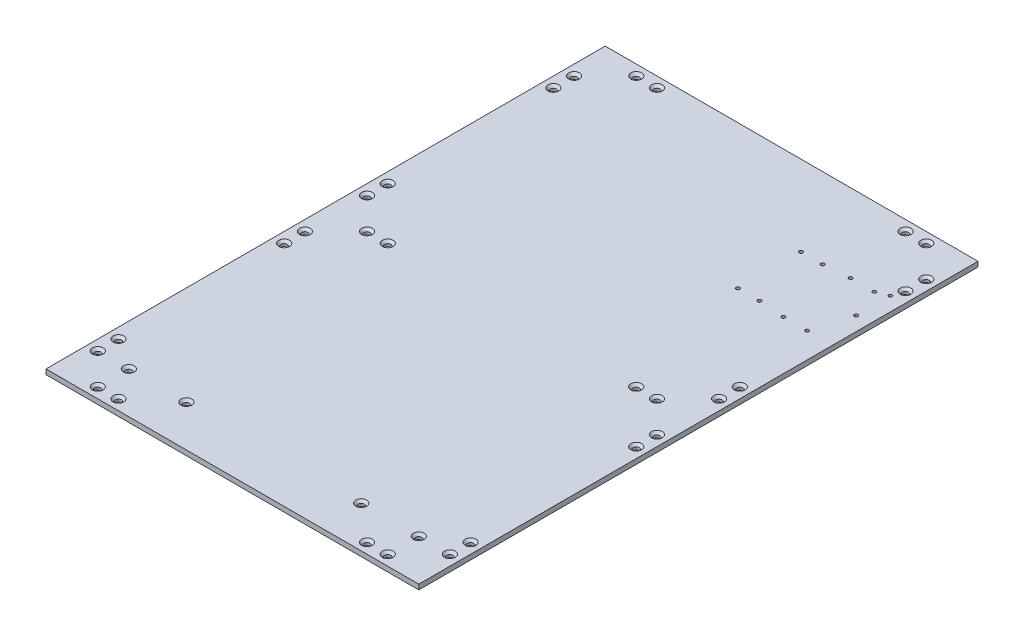
from build123d import *

# Parameters (mm, degrees)
SKETCH1_W                                      = 360
SKETCH1_H                                      = 540
BOSS_EXTRUDE1_DEPTH                            = 4.826
CSK_FOR_M5_FLAT_HEAD_MACHINE_SCREW1_AT_2_COUNT = 2
CSK_FOR_M5_FLAT_HEAD_MACHINE_SCREW1_AT_2_PITCH = 55.5625
CSK_FOR_M5_FLAT_HEAD_MACHINE_SCREW1_AT_3_COUNT = 2
CSK_FOR_M5_FLAT_HEAD_MACHINE_SCREW1_AT_3_PITCH = 224.4375
CSK_FOR_M5_FLAT_HEAD_MACHINE_SCREW1_AT_4_COUNT = 2
CSK_FOR_M5_FLAT_HEAD_MACHINE_SCREW1_AT_4_PITCH = 280
CSK_FOR_M5_FLAT_HEAD_MACHINE_SCREW2_AT_2_COUNT = 2
CSK_FOR_M5_FLAT_HEAD_MACHINE_SCREW2_AT_2_PITCH = 42.426406871
CSK_FOR_M5_FLAT_HEAD_MACHINE_SCREW2_AT_3_COUNT = 2
CSK_FOR_M5_FLAT_HEAD_MACHINE_SCREW2_AT_3_PITCH = 280
CSK_FOR_M5_FLAT_HEAD_MACHINE_SCREW2_AT_4_COUNT = 2
CSK_FOR_M5_FLAT_HEAD_MACHINE_SCREW2_AT_4_PITCH = 311.448230048
CSK_FOR_M5_FLAT_HEAD_MACHINE_SCREW2_AT_5_COUNT = 2
CSK_FOR_M5_FLAT_HEAD_MACHINE_SCREW2_AT_5_PITCH = 231.948270095
CSK_FOR_M5_FLAT_HEAD_MACHINE_SCREW2_AT_6_COUNT = 2
CSK_FOR_M5_FLAT_HEAD_MACHINE_SCREW2_AT_6_PITCH = 260
CSK_FOR_M5_FLAT_HEAD_MACHINE_SCREW2_AT_7_COUNT = 2
CSK_FOR_M5_FLAT_HEAD_MACHINE_SCREW2_AT_7_PITCH = 291.547594742
CSK_FOR_M5_FLAT_HEAD_MACHINE_SCREW2_AT_8_COUNT = 2
CSK_FOR_M5_FLAT_HEAD_MACHINE_SCREW2_AT_8_PITCH = 386.005181312
CSK_FOR_M5_FLAT_HEAD_MACHINE_SCREW2_AT_9_COUNT = 2
CSK_FOR_M5_FLAT_HEAD_MACHINE_SCREW2_AT_9_PITCH = 382.099463491
CSK_FOR_M5_FLAT_HEAD_MACHINE_SCREW2_AT_1_COUNT = 2
CSK_FOR_M5_FLAT_HEAD_MACHINE_SCREW2_AT_1_PITCH = 424.499705536
CSK_FOR_M5_FLAT_HEAD_MACHINE_SCREW2_2_COUNT    = 2
CSK_FOR_M5_FLAT_HEAD_MACHINE_SCREW2_2_PITCH    = 490.917508345
CSK_FOR_M5_FLAT_HEAD_MACHINE_SCREW2_3_COUNT    = 2
CSK_FOR_M5_FLAT_HEAD_MACHINE_SCREW2_3_PITCH    = 520
CSK_FOR_M5_FLAT_HEAD_MACHINE_SCREW2_4_COUNT    = 2
CSK_FOR_M5_FLAT_HEAD_MACHINE_SCREW2_4_PITCH    = 590.592922409
CSK_FOR_M5_FLAT_HEAD_MACHINE_SCREW2_5_COUNT    = 2
CSK_FOR_M5_FLAT_HEAD_MACHINE_SCREW2_5_PITCH    = 579.827560573
CSK_FOR_M5_FLAT_HEAD_MACHINE_SCREW2_6_COUNT    = 2
CSK_FOR_M5_FLAT_HEAD_MACHINE_SCREW2_6_PITCH    = 470.956473573
CSK_FOR_M5_FLAT_HEAD_MACHINE_SCREW2_7_COUNT    = 2
CSK_FOR_M5_FLAT_HEAD_MACHINE_SCREW2_7_PITCH    = 520.38447325
CSK_FOR_M5_FLAT_HEAD_MACHINE_SCREW2_8_COUNT    = 2
CSK_FOR_M5_FLAT_HEAD_MACHINE_SCREW2_8_PITCH    = 581.37767415
CSK_FOR_M5_FLAT_HEAD_MACHINE_SCREW2_9_COUNT    = 2
CSK_FOR_M5_FLAT_HEAD_MACHINE_SCREW2_9_PITCH    = 563.02753041
CSK_FOR_M5_FLAT_HEAD_MACHINE_SCREW2_10_COUNT   = 2
CSK_FOR_M5_FLAT_HEAD_MACHINE_SCREW2_10_PITCH   = 438.406204336
CSK_FOR_M5_FLAT_HEAD_MACHINE_SCREW2_11_COUNT   = 2
CSK_FOR_M5_FLAT_HEAD_MACHINE_SCREW2_11_PITCH   = 367.695526217
CSK_FOR_M5_FLAT_HEAD_MACHINE_SCREW2_12_COUNT   = 2
CSK_FOR_M5_FLAT_HEAD_MACHINE_SCREW2_12_PITCH   = 374.432904537
CSK_FOR_M5_FLAT_HEAD_MACHINE_SCREW2_13_COUNT   = 2
CSK_FOR_M5_FLAT_HEAD_MACHINE_SCREW2_13_PITCH   = 212.132034356
CSK_FOR_M5_FLAT_HEAD_MACHINE_SCREW2_14_COUNT   = 2
CSK_FOR_M5_FLAT_HEAD_MACHINE_SCREW2_14_PITCH   = 260.768096208
CSK_FOR_M5_FLAT_HEAD_MACHINE_SCREW2_15_COUNT   = 2
CSK_FOR_M5_FLAT_HEAD_MACHINE_SCREW2_15_PITCH   = 311.448230048
CSK_FOR_M5_FLAT_HEAD_MACHINE_SCREW2_16_COUNT   = 2
CSK_FOR_M5_FLAT_HEAD_MACHINE_SCREW2_16_PITCH   = 58.309518948
CSK_FOR_M5_FLAT_HEAD_MACHINE_SCREW2_17_COUNT   = 2
CSK_FOR_M5_FLAT_HEAD_MACHINE_SCREW2_17_PITCH   = 20
CSK_FOR_M5_FLAT_HEAD_MACHINE_SCREW2_18_COUNT   = 2
CSK_FOR_M5_FLAT_HEAD_MACHINE_SCREW2_18_PITCH   = 260
CSK_FOR_M5_FLAT_HEAD_MACHINE_SCREW2_19_COUNT   = 2
CSK_FOR_M5_FLAT_HEAD_MACHINE_SCREW2_19_PITCH   = 314.006369362
SKETCH22_R                                     = 1.8
SKETCH22_R_2                                   = 1.7
CUT_EXTRUDE2_DEPTH                             = 9.826000001


with BuildPart() as part:
    # Sketch1 → Boss-Extrude1 (new body)
    with BuildSketch(Plane(origin=(0, 0, 0), x_dir=(1, 0, 0), z_dir=(0, 1, 0))):
        with Locations((180, 270)):
            Rectangle(SKETCH1_W, SKETCH1_H)
    extrude(amount=BOSS_EXTRUDE1_DEPTH)

    # Sketch16 → CSK for M5 Flat Head Machine Screw1 (revolve, cut)
    with BuildSketch(Plane(origin=(40, 4.826, -40), x_dir=(0, 0, 1), z_dir=(1, 0, 0))):
        Polygon((0, 0), (0, 4.826), (2.9, 4.826), (2.9, 2.3), (5.2, 0), align=None)
    csk_for_m5_flat_head_machine_screw1 = revolve(axis=Axis((40, 11.176, -40), (0, -1, 0)), mode=Mode.SUBTRACT)

    # CSK for M5 Flat Head Machine Screw1 at 2: CSK for M5 Flat Head Machine Screw1 ×2
    with Locations(*[(i * CSK_FOR_M5_FLAT_HEAD_MACHINE_SCREW1_AT_2_PITCH, 0, 0) for i in range(1, CSK_FOR_M5_FLAT_HEAD_MACHINE_SCREW1_AT_2_COUNT)]):
        add(csk_for_m5_flat_head_machine_screw1, mode=Mode.SUBTRACT)

    # CSK for M5 Flat Head Machine Screw1 at 3: CSK for M5 Flat Head Machine Screw1 ×2
    with Locations(*[(i * CSK_FOR_M5_FLAT_HEAD_MACHINE_SCREW1_AT_3_PITCH, 0, 0) for i in range(1, CSK_FOR_M5_FLAT_HEAD_MACHINE_SCREW1_AT_3_COUNT)]):
        add(csk_for_m5_flat_head_machine_screw1, mode=Mode.SUBTRACT)

    # CSK for M5 Flat Head Machine Screw1 at 4: CSK for M5 Flat Head Machine Screw1 ×2
    with Locations(*[(i * CSK_FOR_M5_FLAT_HEAD_MACHINE_SCREW1_AT_4_PITCH, 0, 0) for i in range(1, CSK_FOR_M5_FLAT_HEAD_MACHINE_SCREW1_AT_4_COUNT)]):
        add(csk_for_m5_flat_head_machine_screw1, mode=Mode.SUBTRACT)

    # Sketch20 → CSK for M5 Flat Head Machine Screw2 (revolve, cut)
    with BuildSketch(Plane(origin=(40, 4.826, -10), x_dir=(0, 0, 1), z_dir=(1, 0, 0))):
        Polygon((0, 0), (0, 4.826), (2.9, 4.826), (2.9, 2.3), (5.2, 0), align=None)
    csk_for_m5_flat_head_machine_screw2 = revolve(axis=Axis((40, 11.176, -10), (0, -1, 0)), mode=Mode.SUBTRACT)

    # CSK for M5 Flat Head Machine Screw2 at 2: CSK for M5 Flat Head Machine Screw2 ×2
    with Locations(*[Vector(-0.7071067811865477, 0, -0.7071067811865475) * (i * CSK_FOR_M5_FLAT_HEAD_MACHINE_SCREW2_AT_2_PITCH) for i in range(1, CSK_FOR_M5_FLAT_HEAD_MACHINE_SCREW2_AT_2_COUNT)]):
        add(csk_for_m5_flat_head_machine_screw2, mode=Mode.SUBTRACT)

    # CSK for M5 Flat Head Machine Screw2 at 3: CSK for M5 Flat Head Machine Screw2 ×2
    with Locations(*[(i * CSK_FOR_M5_FLAT_HEAD_MACHINE_SCREW2_AT_3_PITCH, 0, 0) for i in range(1, CSK_FOR_M5_FLAT_HEAD_MACHINE_SCREW2_AT_3_COUNT)]):
        add(csk_for_m5_flat_head_machine_screw2, mode=Mode.SUBTRACT)

    # CSK for M5 Flat Head Machine Screw2 at 4: CSK for M5 Flat Head Machine Screw2 ×2
    with Locations(*[Vector(0.9953500135553002, 0, -0.09632419486019045) * (i * CSK_FOR_M5_FLAT_HEAD_MACHINE_SCREW2_AT_4_PITCH) for i in range(1, CSK_FOR_M5_FLAT_HEAD_MACHINE_SCREW2_AT_4_COUNT)]):
        add(csk_for_m5_flat_head_machine_screw2, mode=Mode.SUBTRACT)

    # CSK for M5 Flat Head Machine Screw2 at 5: CSK for M5 Flat Head Machine Screw2 ×2
    with Locations(*[Vector(-0.12933918406776806, 0, -0.9916004111862218) * (i * CSK_FOR_M5_FLAT_HEAD_MACHINE_SCREW2_AT_5_PITCH) for i in range(1, CSK_FOR_M5_FLAT_HEAD_MACHINE_SCREW2_AT_5_COUNT)]):
        add(csk_for_m5_flat_head_machine_screw2, mode=Mode.SUBTRACT)

    # CSK for M5 Flat Head Machine Screw2 at 6: CSK for M5 Flat Head Machine Screw2 ×2
    with Locations(*[(0, 0, -i * CSK_FOR_M5_FLAT_HEAD_MACHINE_SCREW2_AT_6_PITCH) for i in range(1, CSK_FOR_M5_FLAT_HEAD_MACHINE_SCREW2_AT_6_COUNT)]):
        add(csk_for_m5_flat_head_machine_screw2, mode=Mode.SUBTRACT)

    # CSK for M5 Flat Head Machine Screw2 at 7: CSK for M5 Flat Head Machine Screw2 ×2
    with Locations(*[Vector(-0.10289915108550529, 0, -0.9946917938265514) * (i * CSK_FOR_M5_FLAT_HEAD_MACHINE_SCREW2_AT_7_PITCH) for i in range(1, CSK_FOR_M5_FLAT_HEAD_MACHINE_SCREW2_AT_7_COUNT)]):
        add(csk_for_m5_flat_head_machine_screw2, mode=Mode.SUBTRACT)

    # CSK for M5 Flat Head Machine Screw2 at 8: CSK for M5 Flat Head Machine Screw2 ×2
    with Locations(*[Vector(0.8030980282338017, 0, -0.5958469241734659) * (i * CSK_FOR_M5_FLAT_HEAD_MACHINE_SCREW2_AT_8_PITCH) for i in range(1, CSK_FOR_M5_FLAT_HEAD_MACHINE_SCREW2_AT_8_COUNT)]):
        add(csk_for_m5_flat_head_machine_screw2, mode=Mode.SUBTRACT)

    # CSK for M5 Flat Head Machine Screw2 at 9: CSK for M5 Flat Head Machine Screw2 ×2
    with Locations(*[Vector(0.7327934916262991, 0, -0.680451099367278) * (i * CSK_FOR_M5_FLAT_HEAD_MACHINE_SCREW2_AT_9_PITCH) for i in range(1, CSK_FOR_M5_FLAT_HEAD_MACHINE_SCREW2_AT_9_COUNT)]):
        add(csk_for_m5_flat_head_machine_screw2, mode=Mode.SUBTRACT)

    # CSK for M5 Flat Head Machine Screw2 at 1: CSK for M5 Flat Head Machine Screw2 ×2
    with Locations(*[Vector(0.7302714135188955, 0, -0.683157128775741) * (i * CSK_FOR_M5_FLAT_HEAD_MACHINE_SCREW2_AT_1_PITCH) for i in range(1, CSK_FOR_M5_FLAT_HEAD_MACHINE_SCREW2_AT_1_COUNT)]):
        add(csk_for_m5_flat_head_machine_screw2, mode=Mode.SUBTRACT)

    # CSK for M5 Flat Head Machine Screw2  2: CSK for M5 Flat Head Machine Screw2 ×2
    with Locations(*[Vector(-0.0611100632795033, 0, -0.9981310335652204) * (i * CSK_FOR_M5_FLAT_HEAD_MACHINE_SCREW2_2_PITCH) for i in range(1, CSK_FOR_M5_FLAT_HEAD_MACHINE_SCREW2_2_COUNT)]):
        add(csk_for_m5_flat_head_machine_screw2, mode=Mode.SUBTRACT)

    # CSK for M5 Flat Head Machine Screw2  3: CSK for M5 Flat Head Machine Screw2 ×2
    with Locations(*[(0, 0, -i * CSK_FOR_M5_FLAT_HEAD_MACHINE_SCREW2_3_PITCH) for i in range(1, CSK_FOR_M5_FLAT_HEAD_MACHINE_SCREW2_3_COUNT)]):
        add(csk_for_m5_flat_head_machine_screw2, mode=Mode.SUBTRACT)

    # CSK for M5 Flat Head Machine Screw2  4: CSK for M5 Flat Head Machine Screw2 ×2
    with Locations(*[Vector(0.4740998230350174, 0, -0.8804710999221753) * (i * CSK_FOR_M5_FLAT_HEAD_MACHINE_SCREW2_4_PITCH) for i in range(1, CSK_FOR_M5_FLAT_HEAD_MACHINE_SCREW2_4_COUNT)]):
        add(csk_for_m5_flat_head_machine_screw2, mode=Mode.SUBTRACT)

    # CSK for M5 Flat Head Machine Screw2  5: CSK for M5 Flat Head Machine Screw2 ×2
    with Locations(*[Vector(0.5346417126044627, 0, -0.8450788360522153) * (i * CSK_FOR_M5_FLAT_HEAD_MACHINE_SCREW2_5_PITCH) for i in range(1, CSK_FOR_M5_FLAT_HEAD_MACHINE_SCREW2_5_COUNT)]):
        add(csk_for_m5_flat_head_machine_screw2, mode=Mode.SUBTRACT)

    # CSK for M5 Flat Head Machine Screw2  6: CSK for M5 Flat Head Machine Screw2 ×2
    with Locations(*[Vector(-0.06370015422533803, 0, -0.9979690828636267) * (i * CSK_FOR_M5_FLAT_HEAD_MACHINE_SCREW2_6_PITCH) for i in range(1, CSK_FOR_M5_FLAT_HEAD_MACHINE_SCREW2_6_COUNT)]):
        add(csk_for_m5_flat_head_machine_screw2, mode=Mode.SUBTRACT)

    # CSK for M5 Flat Head Machine Screw2  7: CSK for M5 Flat Head Machine Screw2 ×2
    with Locations(*[Vector(0.03843312210120418, 0, -0.9992611746313144) * (i * CSK_FOR_M5_FLAT_HEAD_MACHINE_SCREW2_7_PITCH) for i in range(1, CSK_FOR_M5_FLAT_HEAD_MACHINE_SCREW2_7_COUNT)]):
        add(csk_for_m5_flat_head_machine_screw2, mode=Mode.SUBTRACT)

    # CSK for M5 Flat Head Machine Screw2  8: CSK for M5 Flat Head Machine Screw2 ×2
    with Locations(*[Vector(0.4472135954999574, 0, -0.8944271909999162) * (i * CSK_FOR_M5_FLAT_HEAD_MACHINE_SCREW2_8_PITCH) for i in range(1, CSK_FOR_M5_FLAT_HEAD_MACHINE_SCREW2_8_COUNT)]):
        add(csk_for_m5_flat_head_machine_screw2, mode=Mode.SUBTRACT)

    # CSK for M5 Flat Head Machine Screw2  9: CSK for M5 Flat Head Machine Screw2 ×2
    with Locations(*[Vector(0.5505947458271752, 0, -0.8347726791573312) * (i * CSK_FOR_M5_FLAT_HEAD_MACHINE_SCREW2_9_PITCH) for i in range(1, CSK_FOR_M5_FLAT_HEAD_MACHINE_SCREW2_9_COUNT)]):
        add(csk_for_m5_flat_head_machine_screw2, mode=Mode.SUBTRACT)

    # CSK for M5 Flat Head Machine Screw2  10: CSK for M5 Flat Head Machine Screw2 ×2
    with Locations(*[Vector(0.7071067811865475, 0, -0.7071067811865476) * (i * CSK_FOR_M5_FLAT_HEAD_MACHINE_SCREW2_10_PITCH) for i in range(1, CSK_FOR_M5_FLAT_HEAD_MACHINE_SCREW2_10_COUNT)]):
        add(csk_for_m5_flat_head_machine_screw2, mode=Mode.SUBTRACT)

    # CSK for M5 Flat Head Machine Screw2  11: CSK for M5 Flat Head Machine Screw2 ×2
    with Locations(*[Vector(0.7071067811865476, 0, -0.7071067811865476) * (i * CSK_FOR_M5_FLAT_HEAD_MACHINE_SCREW2_11_PITCH) for i in range(1, CSK_FOR_M5_FLAT_HEAD_MACHINE_SCREW2_11_COUNT)]):
        add(csk_for_m5_flat_head_machine_screw2, mode=Mode.SUBTRACT)

    # CSK for M5 Flat Head Machine Screw2  12: CSK for M5 Flat Head Machine Screw2 ×2
    with Locations(*[Vector(0.827918690488332, 0, -0.5608481451695152) * (i * CSK_FOR_M5_FLAT_HEAD_MACHINE_SCREW2_12_PITCH) for i in range(1, CSK_FOR_M5_FLAT_HEAD_MACHINE_SCREW2_12_COUNT)]):
        add(csk_for_m5_flat_head_machine_screw2, mode=Mode.SUBTRACT)

    # CSK for M5 Flat Head Machine Screw2  13: CSK for M5 Flat Head Machine Screw2 ×2
    with Locations(*[Vector(-0.14142135623730953, 0, -0.9899494936611666) * (i * CSK_FOR_M5_FLAT_HEAD_MACHINE_SCREW2_13_PITCH) for i in range(1, CSK_FOR_M5_FLAT_HEAD_MACHINE_SCREW2_13_COUNT)]):
        add(csk_for_m5_flat_head_machine_screw2, mode=Mode.SUBTRACT)

    # CSK for M5 Flat Head Machine Screw2  14: CSK for M5 Flat Head Machine Screw2 ×2
    with Locations(*[Vector(0.07669649888473705, 0, -0.9970544855015816) * (i * CSK_FOR_M5_FLAT_HEAD_MACHINE_SCREW2_14_PITCH) for i in range(1, CSK_FOR_M5_FLAT_HEAD_MACHINE_SCREW2_14_COUNT)]):
        add(csk_for_m5_flat_head_machine_screw2, mode=Mode.SUBTRACT)

    # CSK for M5 Flat Head Machine Screw2  15: CSK for M5 Flat Head Machine Screw2 ×2
    with Locations(*[Vector(-0.09632419486019039, 0, -0.9953500135553002) * (i * CSK_FOR_M5_FLAT_HEAD_MACHINE_SCREW2_15_PITCH) for i in range(1, CSK_FOR_M5_FLAT_HEAD_MACHINE_SCREW2_15_COUNT)]):
        add(csk_for_m5_flat_head_machine_screw2, mode=Mode.SUBTRACT)

    # CSK for M5 Flat Head Machine Screw2  16: CSK for M5 Flat Head Machine Screw2 ×2
    with Locations(*[Vector(-0.5144957554275267, 0, -0.8574929257125442) * (i * CSK_FOR_M5_FLAT_HEAD_MACHINE_SCREW2_16_PITCH) for i in range(1, CSK_FOR_M5_FLAT_HEAD_MACHINE_SCREW2_16_COUNT)]):
        add(csk_for_m5_flat_head_machine_screw2, mode=Mode.SUBTRACT)

    # CSK for M5 Flat Head Machine Screw2  17: CSK for M5 Flat Head Machine Screw2 ×2
    with Locations(*[(i * CSK_FOR_M5_FLAT_HEAD_MACHINE_SCREW2_17_PITCH, 0, 0) for i in range(1, CSK_FOR_M5_FLAT_HEAD_MACHINE_SCREW2_17_COUNT)]):
        add(csk_for_m5_flat_head_machine_screw2, mode=Mode.SUBTRACT)

    # CSK for M5 Flat Head Machine Screw2  18: CSK for M5 Flat Head Machine Screw2 ×2
    with Locations(*[(i * CSK_FOR_M5_FLAT_HEAD_MACHINE_SCREW2_18_PITCH, 0, 0) for i in range(1, CSK_FOR_M5_FLAT_HEAD_MACHINE_SCREW2_18_COUNT)]):
        add(csk_for_m5_flat_head_machine_screw2, mode=Mode.SUBTRACT)

    # CSK for M5 Flat Head Machine Screw2  19: CSK for M5 Flat Head Machine Screw2 ×2
    with Locations(*[Vector(0.9872411207126471, 0, -0.1592324388246205) * (i * CSK_FOR_M5_FLAT_HEAD_MACHINE_SCREW2_19_PITCH) for i in range(1, CSK_FOR_M5_FLAT_HEAD_MACHINE_SCREW2_19_COUNT)]):
        add(csk_for_m5_flat_head_machine_screw2, mode=Mode.SUBTRACT)

    # Sketch22 → Cut-Extrude2 (cut)
    with BuildSketch(Plane(origin=(0, 9.826000001, 0), x_dir=(1, 0, 0), z_dir=(0, 1, 0))):
        with Locations(Location((266.6, 462.5, 0), (0, 0, 270))):
            Circle(SKETCH22_R)
        with Locations(Location((287.5, 462.5, 0), (0, 0, 270))):
            Circle(SKETCH22_R)
        with Locations(Location((287.5, 401.5, 0), (0, 0, 270))):
            Circle(SKETCH22_R)
        with Locations(Location((312.5, 399.499999999, 0), (0, 0, 270))):
            Circle(SKETCH22_R_2)
        with Locations(Location((266.6, 401.5, 0), (0, 0, 270))):
            Circle(SKETCH22_R)
        with Locations(Location((312.5, 464.499999999, 0), (0, 0, 270))):
            Circle(SKETCH22_R_2)
        with Locations(Location((335.5, 464.499999999, 0), (0, 0, 270))):
            Circle(SKETCH22_R_2)
        with Locations(Location((335.5, 399.499999999, 0), (0, 0, 270))):
            Circle(SKETCH22_R_2)
        with Locations(Location((346.5, 435.837822173, 0), (0, 0, 270))):
            Circle(SKETCH22_R_2)
        with Locations(Location((346.5, 468.837822173, 0), (0, 0, 270))):
            Circle(SKETCH22_R_2)
    extrude(amount=-CUT_EXTRUDE2_DEPTH, mode=Mode.SUBTRACT)


solid = part.part
